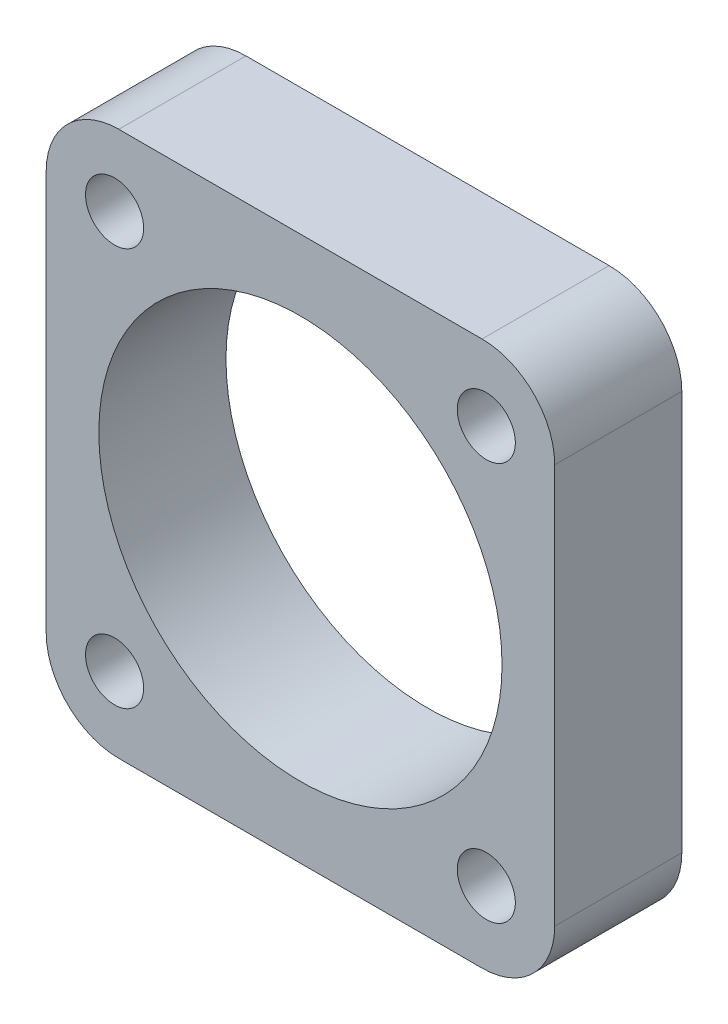
from build123d import *

# Parameters (mm, degrees)
SKETCH1_W           = 28
SKETCH1_H           = 30
SKETCH1_R           = 11.1
SKETCH1_R_2         = 1.6
BOSS_EXTRUDE1_DEPTH = 7
SKETCH1_4_R         = 1.6
CUT_EXTRUDE3_DEPTH  = 3
FILLET5_R           = 4


with BuildPart() as part:
    # Sketch1 → Boss-Extrude1 (new body)
    with BuildSketch(Plane.XY):
        Rectangle(SKETCH1_W, SKETCH1_H)
        Circle(SKETCH1_R, mode=Mode.SUBTRACT)
        with Locations((-10.234773755, -10.965829024)):
            Circle(SKETCH1_R_2, mode=Mode.SUBTRACT)
        with Locations((10.234773755, -10.965829024)):
            Circle(SKETCH1_R_2, mode=Mode.SUBTRACT)
        with Locations((-10.234773755, 10.965829024)):
            Circle(SKETCH1_R_2, mode=Mode.SUBTRACT)
        with Locations((10.234773755, 10.965829024)):
            Circle(SKETCH1_R_2, mode=Mode.SUBTRACT)
    extrude(amount=BOSS_EXTRUDE1_DEPTH)

    # Sketch1<4> → Cut-Extrude3 (cut)
    # profile 1 of 4: a face of its own
    with BuildSketch(Plane.XY):
        Polygon((-12.984773755, 9.378115783), (-10.234773755, 7.790402543), (-7.484773755, 9.378115783), (-7.484773755, 12.553542264), (-10.234773755, 14.141255504), (-12.984773755, 12.553542264), align=None)
        with Locations((-10.234773755, 10.965829024)):
            Circle(SKETCH1_4_R, mode=Mode.SUBTRACT)
    # profile 2 of 4: a face of its own
    with BuildSketch(Plane.XY):
        Polygon((10.234773755, 7.790402543), (12.984773755, 9.378115783), (12.984773755, 12.553542264), (10.234773755, 14.141255504), (7.484773755, 12.553542264), (7.484773755, 9.378115783), align=None)
        with Locations((10.234773755, 10.965829024)):
            Circle(SKETCH1_4_R, mode=Mode.SUBTRACT)
    # profile 3 of 4: a face of its own
    with BuildSketch(Plane.XY):
        Polygon((-7.484773755, -9.378115783), (-10.234773755, -7.790402543), (-12.984773755, -9.378115783), (-12.984773755, -12.553542264), (-10.234773755, -14.141255504), (-7.484773755, -12.553542264), align=None)
        with Locations((-10.234773755, -10.965829024)):
            Circle(SKETCH1_4_R, mode=Mode.SUBTRACT)
    # profile 4 of 4: a face of its own
    with BuildSketch(Plane.XY):
        Polygon((12.984773755, -12.553542264), (12.984773755, -9.378115783), (10.234773755, -7.790402543), (7.484773755, -9.378115783), (7.484773755, -12.553542264), (10.234773755, -14.141255504), align=None)
        with Locations((10.234773755, -10.965829024)):
            Circle(SKETCH1_4_R, mode=Mode.SUBTRACT)
    extrude(amount=CUT_EXTRUDE3_DEPTH, mode=Mode.SUBTRACT)

    # Fillet5
    fillet5_edges = [part.edges().sort_by_distance(p)[0] for p in [
        (-14, 15, 3.5),
        (-14, -15, 3.5),
        (14, 15, 3.5),
        (14, -15, 3.5),
    ]]
    fillet(fillet5_edges, radius=FILLET5_R)


solid = part.part
